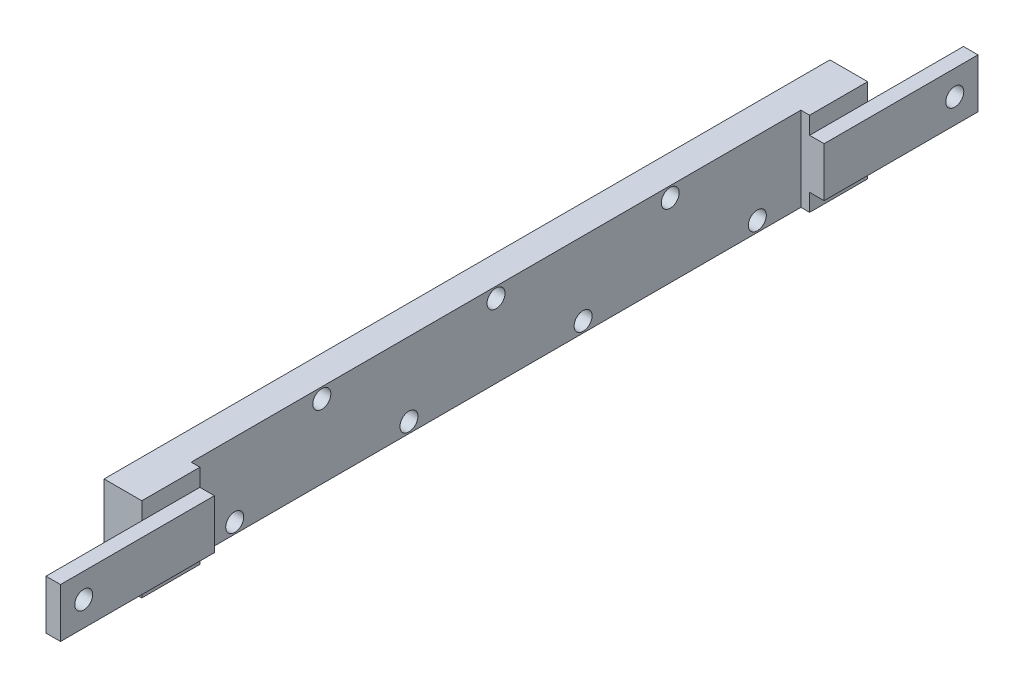
from build123d import *

# Parameters (mm, degrees)
SKETCH_1_W          = 250
SKETCH_1_H          = 29
EXTRUDE_1_DEPTH     = 10
SKETCH_1_3_R        = 3.1
CUT_EXTRUDE_1_DEPTH = 127.234900087
SKETCH_3_W          = 20
SKETCH_3_H          = 29
EXTRUDE_2_DEPTH     = 3
SKETCH_4_W          = 53
SKETCH_4_H          = 17
SKETCH_4_R          = 3.1
EXTRUDE_3_DEPTH     = 5


with BuildPart() as part:
    # 草图1 → 凸台-拉伸1 (new body)
    with BuildSketch(Plane(origin=(0, 0, 0), x_dir=(0, 0, -1), z_dir=(1, 0, 0))):
        Rectangle(SKETCH_1_W, SKETCH_1_H)
    extrude(amount=EXTRUDE_1_DEPTH)

    # 草图1<3> → 切除-拉伸1 (cut, through all)
    with BuildSketch(Plane(origin=(0, 0, 0), x_dir=(0, 0, -1), z_dir=(1, 0, 0))):
        with Locations((-90, -10.858617882)):
            Circle(SKETCH_1_3_R)
        with Locations((-30, -10.858617882)):
            Circle(SKETCH_1_3_R)
        with Locations((30, -10.858617882)):
            Circle(SKETCH_1_3_R)
        with Locations((-60, 10.858617882)):
            Circle(SKETCH_1_3_R)
        with Locations((90, -10.858617882)):
            Circle(SKETCH_1_3_R)
        with Locations((0, 10.858617882)):
            Circle(SKETCH_1_3_R)
        with Locations((60, 10.858617882)):
            Circle(SKETCH_1_3_R)
    extrude(amount=CUT_EXTRUDE_1_DEPTH, mode=Mode.SUBTRACT)

    # 草图3 → 凸台-拉伸2 (add)
    with BuildSketch(Plane(origin=(10, 0, 0), x_dir=(0, 0, -1), z_dir=(1, 0, 0))):
        with Locations((115, 0)):
            Rectangle(SKETCH_3_W, SKETCH_3_H)
        with Locations((-115, 0)):
            Rectangle(SKETCH_3_W, SKETCH_3_H)
    extrude(amount=EXTRUDE_2_DEPTH)

    # 草图4 → 凸台-拉伸3 (add)
    # profile 1 of 2: a face of its own
    with BuildSketch(Plane(origin=(13, 0, 0), x_dir=(0, 0, -1), z_dir=(1, 0, 0))):
        with Locations((131.5, 0)):
            Rectangle(SKETCH_4_W, SKETCH_4_H)
        with Locations((150, 0)):
            Circle(SKETCH_4_R, mode=Mode.SUBTRACT)
    # profile 2 of 2: a face of its own
    with BuildSketch(Plane(origin=(13, 0, 0), x_dir=(0, 0, -1), z_dir=(1, 0, 0))):
        with Locations((-131.5, 0)):
            Rectangle(SKETCH_4_W, SKETCH_4_H)
        with Locations((-150, 0)):
            Circle(SKETCH_4_R, mode=Mode.SUBTRACT)
    extrude(amount=EXTRUDE_3_DEPTH)


solid = part.part
